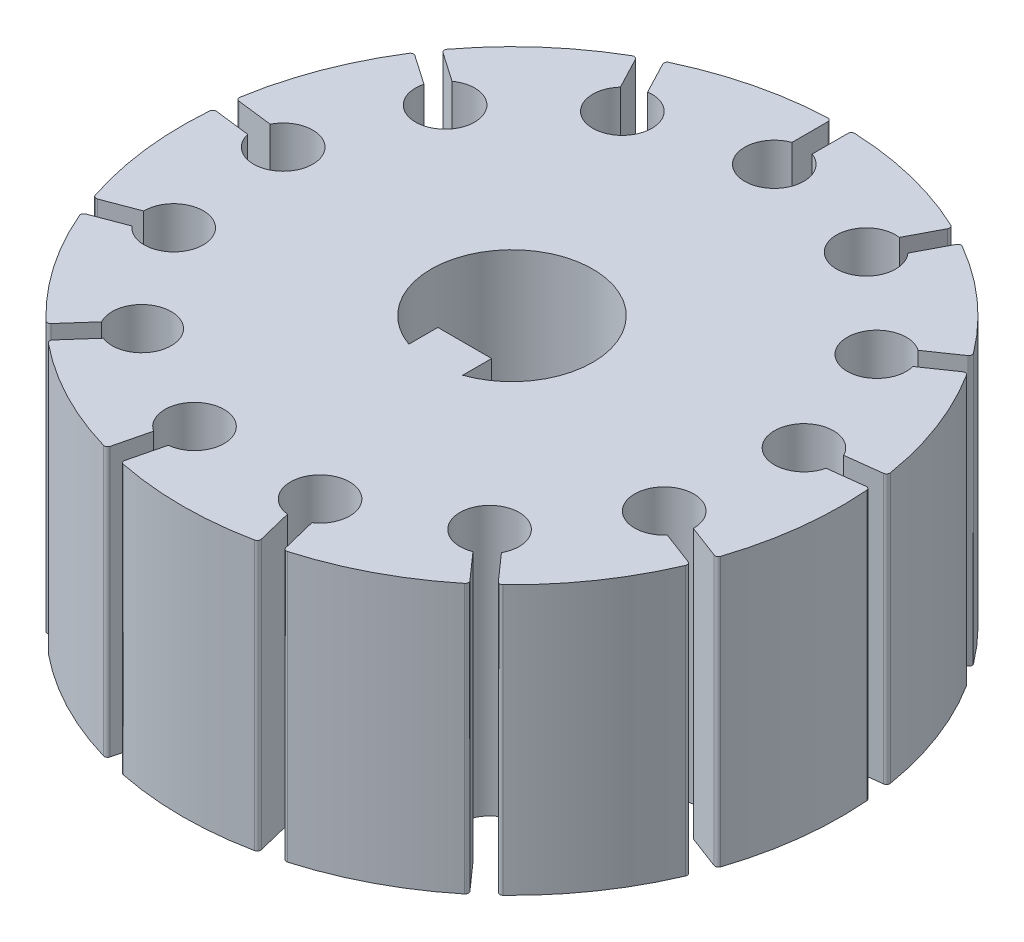
from build123d import *

# Parameters (mm, degrees)
SKETCH1_R                = 24.5
BOSS_EXTRUDE1_DEPTH      = 20
CUT_EXTRUDE1_DEPTH       = 41.006249512
FILLET1_R                = 0.25
CIRPATTERN1_COUNT        = 13
FILLET1_OF_CIRPATTERN1_R = 0.25


with BuildPart() as part:
    # Sketch1 → Boss-Extrude1 (new body)
    with BuildSketch(Plane(origin=(0, 0, 0), x_dir=(1, 0, 0), z_dir=(0, 1, 0))):
        with Locations(Location((0, 0, 0), (0, 0, 270))):
            Circle(SKETCH1_R)
        with BuildLine():
            Line((2, -5.667459748), (2, -3.51))
            Line((2, -3.51), (-2, -3.51))
            Line((-2, -3.51), (-2, -5.667459748))
            ThreePointArc((-2, -5.667459748), (0, 6.01), (2, -5.667459748))
        make_face(mode=Mode.SUBTRACT)
    extrude(amount=BOSS_EXTRUDE1_DEPTH)

    # Sketch3 → Cut-Extrude1 (cut, through all)
    with BuildSketch(Plane(origin=(0, 20, 0), x_dir=(1, 0, 0), z_dir=(0, 1, 0))):
        with BuildLine():
            Line((0.75, 21.568211788), (0.75, 24.5))
            Line((0.75, 24.5), (-0.75, 24.5))
            Line((-0.75, 24.5), (-0.75, 21.568211788))
            ThreePointArc((-0.75, 21.568211788), (0, 17.3), (0.75, 21.568211788))
        make_face()
    cut_extrude1 = extrude(amount=-CUT_EXTRUDE1_DEPTH, mode=Mode.SUBTRACT)

    # Fillet1
    fillet1_edges = [part.edges().sort_by_distance(p)[0] for p in [
        (0.75, 10, -24.488517717),
        (-0.75, 10, -24.488517717),
    ]]
    fillet(fillet1_edges, radius=FILLET1_R)

    # CirPattern1: Cut-Extrude1 ×13 about axis
    cirpattern1_axis = Axis((0, 0, 0), (0, 1, 0))
    for i in range(1, CIRPATTERN1_COUNT):
        add(cut_extrude1.rotate(cirpattern1_axis, i * 360 / CIRPATTERN1_COUNT), mode=Mode.SUBTRACT)

    # Fillet1 of CirPattern1
    fillet1_of_cirpattern1_edges = [part.edges().sort_by_distance(p)[0] for p in [
        (-10.716289613, 10, -22.032047951),
        (-12.044473652, 10, -21.334963193),
        (-19.727606421, 10, -14.528301514),
        (-20.579703541, 10, -13.293825716),
        (-24.219566341, 10, -3.696296286),
        (-24.400371362, 10, -2.207232974),
        (-23.16311549, 10, 7.982485877),
        (-22.63120816, 10, 9.385010241),
        (-16.800274026, 10, 17.832576725),
        (-15.677507904, 10, 18.827260712),
        (-6.588692248, 10, 23.59743915),
        (-5.132279522, 10, 23.956412647),
        (5.132279522, 10, 23.956412647),
        (6.588692248, 10, 23.59743915),
        (15.677507904, 10, 18.827260712),
        (16.800274026, 10, 17.832576725),
        (22.63120816, 10, 9.385010241),
        (23.16311549, 10, 7.982485877),
        (24.400371362, 10, -2.207232974),
        (24.219566341, 10, -3.696296286),
        (20.579703541, 10, -13.293825716),
        (19.727606421, 10, -14.528301514),
        (12.044473652, 10, -21.334963193),
        (10.716289613, 10, -22.032047951),
    ]]
    fillet(fillet1_of_cirpattern1_edges, radius=FILLET1_OF_CIRPATTERN1_R)


solid = part.part
